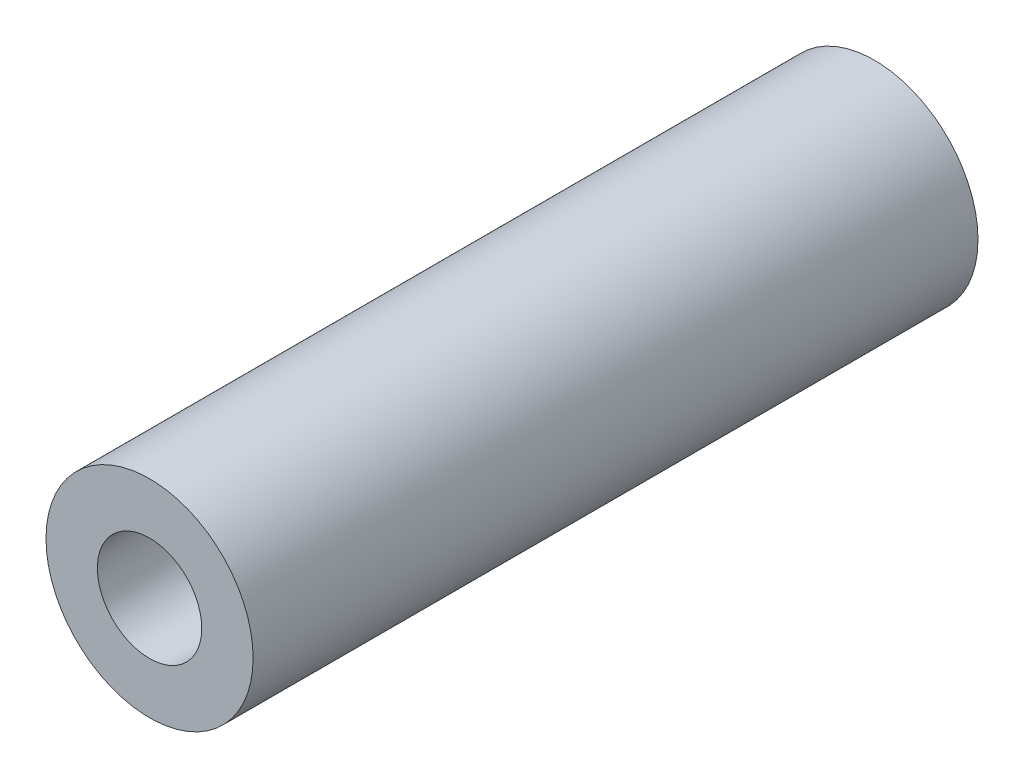
from build123d import *

# Parameters (mm, degrees)
SKETCH1_R      = 6.35
SKETCH1_R_2    = 3.2004
EXTRUDE1_DEPTH = 22.225


with BuildPart() as part:
    # Sketch1 → Extrude1 (new, symmetric)
    with BuildSketch(Plane.XY):
        Circle(SKETCH1_R)
        Circle(SKETCH1_R_2, mode=Mode.SUBTRACT)
    extrude(amount=EXTRUDE1_DEPTH, both=True)


solid = part.part
